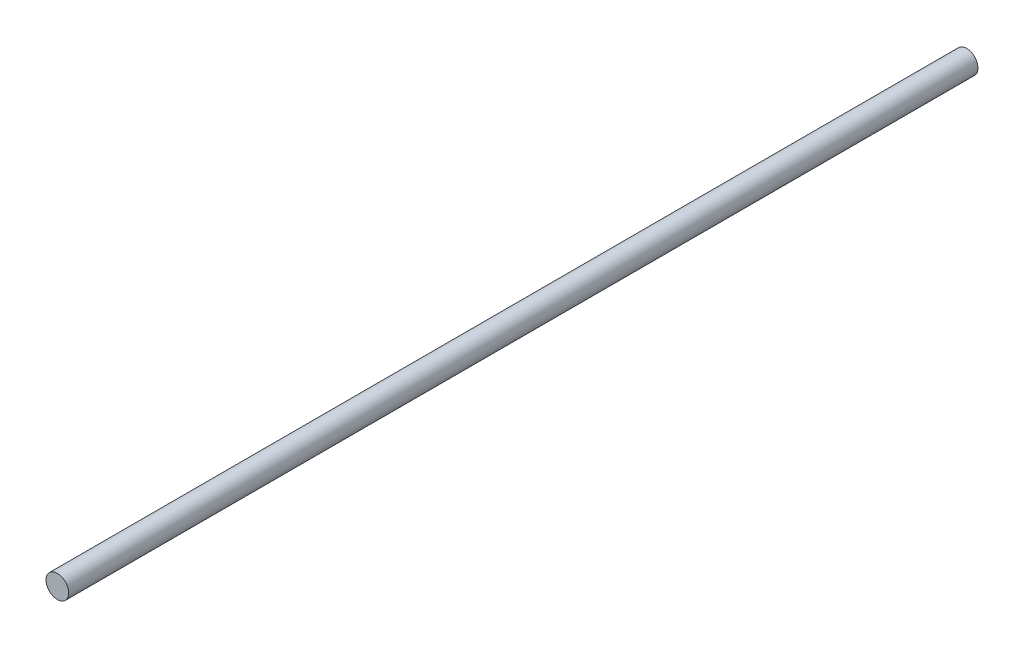
from build123d import *

# Parameters (mm, degrees)
SKETCH1_R           = 2.5
BOSS_EXTRUDE1_DEPTH = 200


with BuildPart() as part:
    # Sketch1 → Boss-Extrude1 (new body)
    with BuildSketch(Plane.XY):
        Circle(SKETCH1_R)
    extrude(amount=BOSS_EXTRUDE1_DEPTH)


solid = part.part
